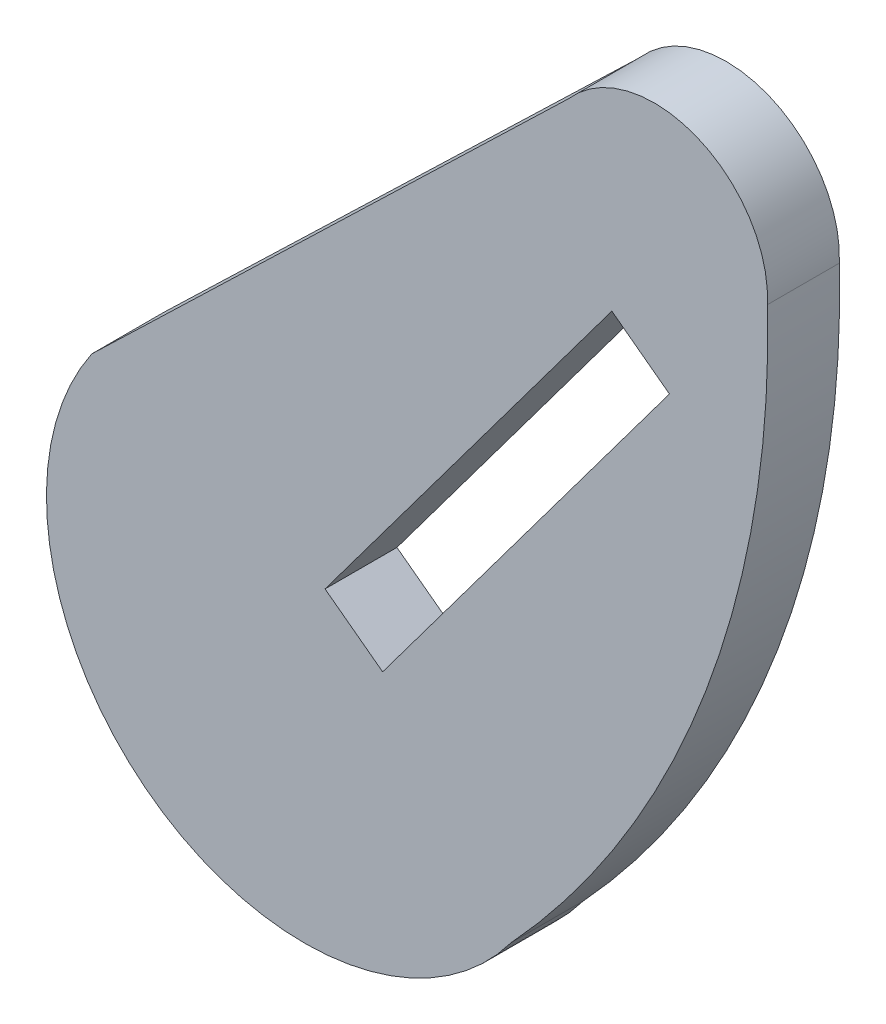
from build123d import *

# Parameters (mm, degrees)
BASE_EXTRUDE_DEPTH = 3


with BuildPart() as part:
    # Sketch1 → Base-Extrude (new body)
    with BuildSketch(Plane.XY):
        with BuildLine():
            Line((-809.531671811, -111.229676779), (-789.61413801, -92.039559057))
            ThreePointArc((-789.61413801, -92.039559057), (-784.29578657, -90.751569276), (-781.326120484, -95.347748455))
            ThreePointArc((-781.326120484, -95.347748455), (-783.901412566, -110.604895358), (-792.031629072, -123.769706047))
            ThreePointArc((-792.031629072, -123.769706047), (-806.92926697, -126.078902011), (-809.531671811, -111.229676779))
        make_face()
        Polygon((-797.390770347, -116.654380858), (-785.418685199, -100.624013922), (-787.82232857, -98.82888202), (-799.794413717, -114.859248956), align=None, mode=Mode.SUBTRACT)
    extrude(amount=BASE_EXTRUDE_DEPTH)


solid = part.part
